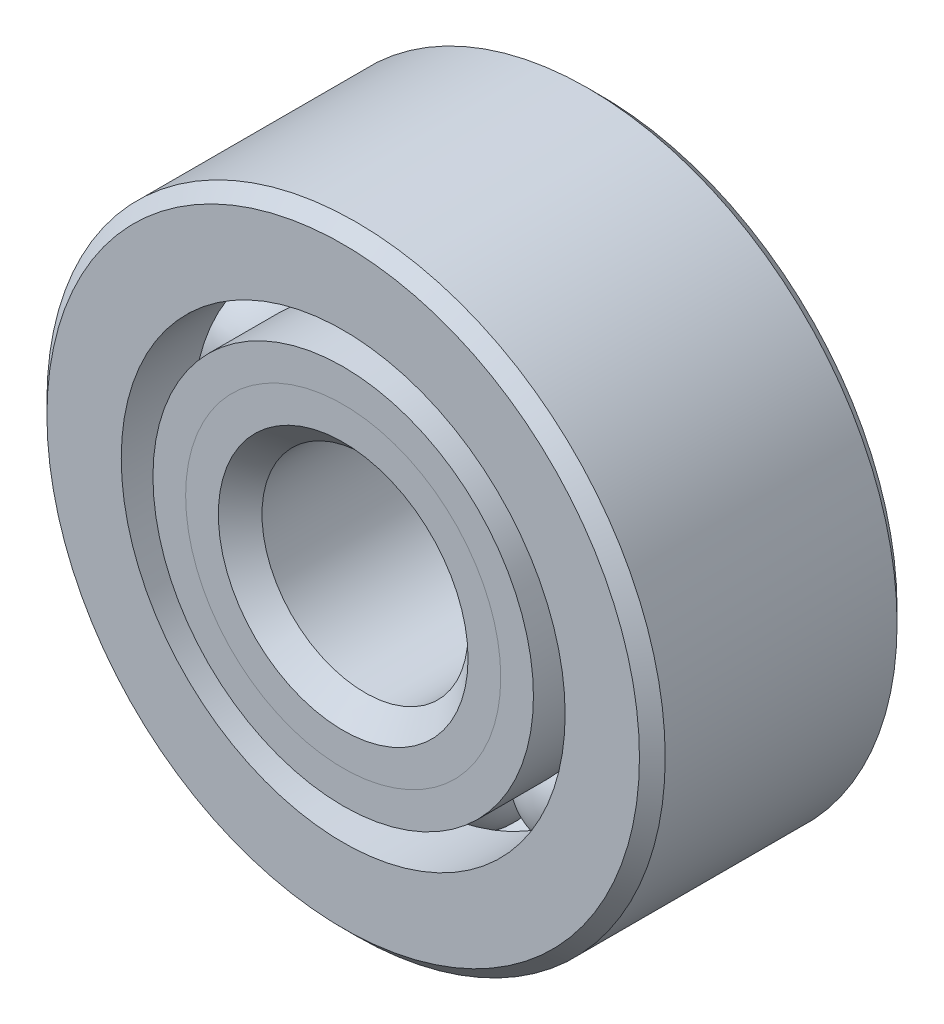
from build123d import *

# Parameters (mm, degrees)
CIRPATTERN1_COUNT = 10


with BuildPart() as part:
    # Sketch1 → Revolve1 (revolve)
    with BuildSketch(Plane(origin=(0, 0, 0), x_dir=(0, 0, -1), z_dir=(1, 0, 0))):
        with BuildLine():
            Line((1.7859375, 4.7625), (-1.7859375, 4.7625))
            Line((-1.7859375, 4.7625), (-1.984375, 4.5640625))
            Line((-1.984375, 4.5640625), (-1.984375, 3.419230769))
            Line((-1.984375, 3.419230769), (-0.881944444, 3.419230769))
            ThreePointArc((-0.881944444, 3.419230769), (0, 4.090136422), (0.881944444, 3.419230769))
            Line((0.881944444, 3.419230769), (1.984375, 3.419230769))
            Line((1.984375, 3.419230769), (1.984375, 4.5640625))
            Line((1.984375, 4.5640625), (1.7859375, 4.7625))
        make_face()
    revolve(axis=Axis((0, 0, 1.984375), (0, 0, -1)))


with BuildPart() as body_2:
    # Sketch2 → Revolve2 (revolve)
    with BuildSketch(Plane(origin=(0, 0, 0), x_dir=(0, 0, -1), z_dir=(1, 0, 0))):
        with BuildLine():
            Line((-1.984375, 2.930769231), (-0.881944444, 2.930769231))
            ThreePointArc((-0.881944444, 2.930769231), (-0.554062361, 2.446652849), (0, 2.259863578))
            Line((0, 2.259863578), (0, 1.923681789))
            Line((0, 1.923681789), (-1.480831279, 1.923681789))
            Line((-1.480831279, 1.923681789), (-1.984375, 2.42722551))
            Line((-1.984375, 2.42722551), (-1.984375, 2.930769231))
        make_face()
    revolve(axis=Axis((0, 0, 1.984375), (0, 0, -1)))


with BuildPart() as body_3:
    # Sketch3 → Revolve3 (revolve)
    with BuildSketch(Plane(origin=(0, 0, 0), x_dir=(0, 0, -1), z_dir=(1, 0, 0))):
        with BuildLine():
            Line((-1.984375, 2.42722551), (-1.480831279, 1.923681789))
            Line((-1.480831279, 1.923681789), (0, 1.923681789))
            Line((0, 1.923681789), (0, 2.259863578))
            ThreePointArc((0, 2.259863578), (0.554062361, 2.446652849), (0.881944444, 2.930769231))
            Line((0.881944444, 2.930769231), (1.984375, 2.930769231))
            Line((1.984375, 2.930769231), (1.984375, 1.7859375))
            Line((1.984375, 1.7859375), (1.7859375, 1.5875))
            Line((1.7859375, 1.5875), (-1.648193211, 1.5875))
            Line((-1.648193211, 1.5875), (-1.984375, 1.923681789))
            Line((-1.984375, 1.923681789), (-1.984375, 2.42722551))
        make_face()
    revolve(axis=Axis((0, 0, 1.984375), (0, 0, -1)))


with BuildPart() as body_4:
    # Sketch4 → Revolve4 (revolve)
    with BuildSketch(Plane(origin=(0, 0, 0), x_dir=(0, 0, -1), z_dir=(1, 0, 0))):
        with BuildLine():
            Line((-0.915136422, 3.175), (0.915136422, 3.175))
            ThreePointArc((0.915136422, 3.175), (0, 4.090136422), (-0.915136422, 3.175))
        make_face()
    revolve(axis=Axis((0, 3.175, 0.915136422), (0, 0, -1)))


with BuildPart() as cirpattern1_1:
    # CirPattern1: pattern copy
    add(body_4.part.rotate(Axis((0, 0, -1.984375), (0, 0, 1)), 1 * 360 / CIRPATTERN1_COUNT))


with BuildPart() as cirpattern1_2:
    # CirPattern1: pattern copy
    add(body_4.part.rotate(Axis((0, 0, -1.984375), (0, 0, 1)), 2 * 360 / CIRPATTERN1_COUNT))


with BuildPart() as cirpattern1_3:
    # CirPattern1: pattern copy
    add(body_4.part.rotate(Axis((0, 0, -1.984375), (0, 0, 1)), 3 * 360 / CIRPATTERN1_COUNT))


with BuildPart() as cirpattern1_4:
    # CirPattern1: pattern copy
    add(body_4.part.rotate(Axis((0, 0, -1.984375), (0, 0, 1)), 4 * 360 / CIRPATTERN1_COUNT))


with BuildPart() as cirpattern1_5:
    # CirPattern1: pattern copy
    add(body_4.part.rotate(Axis((0, 0, -1.984375), (0, 0, 1)), 5 * 360 / CIRPATTERN1_COUNT))


with BuildPart() as cirpattern1_6:
    # CirPattern1: pattern copy
    add(body_4.part.rotate(Axis((0, 0, -1.984375), (0, 0, 1)), 6 * 360 / CIRPATTERN1_COUNT))


with BuildPart() as cirpattern1_7:
    # CirPattern1: pattern copy
    add(body_4.part.rotate(Axis((0, 0, -1.984375), (0, 0, 1)), 7 * 360 / CIRPATTERN1_COUNT))


with BuildPart() as cirpattern1_8:
    # CirPattern1: pattern copy
    add(body_4.part.rotate(Axis((0, 0, -1.984375), (0, 0, 1)), 8 * 360 / CIRPATTERN1_COUNT))


with BuildPart() as cirpattern1_9:
    # CirPattern1: pattern copy
    add(body_4.part.rotate(Axis((0, 0, -1.984375), (0, 0, 1)), 9 * 360 / CIRPATTERN1_COUNT))


solid = Compound([part.part, body_2.part, body_3.part, body_4.part, cirpattern1_1.part, cirpattern1_2.part, cirpattern1_3.part, cirpattern1_4.part, cirpattern1_5.part, cirpattern1_6.part, cirpattern1_7.part, cirpattern1_8.part, cirpattern1_9.part])
